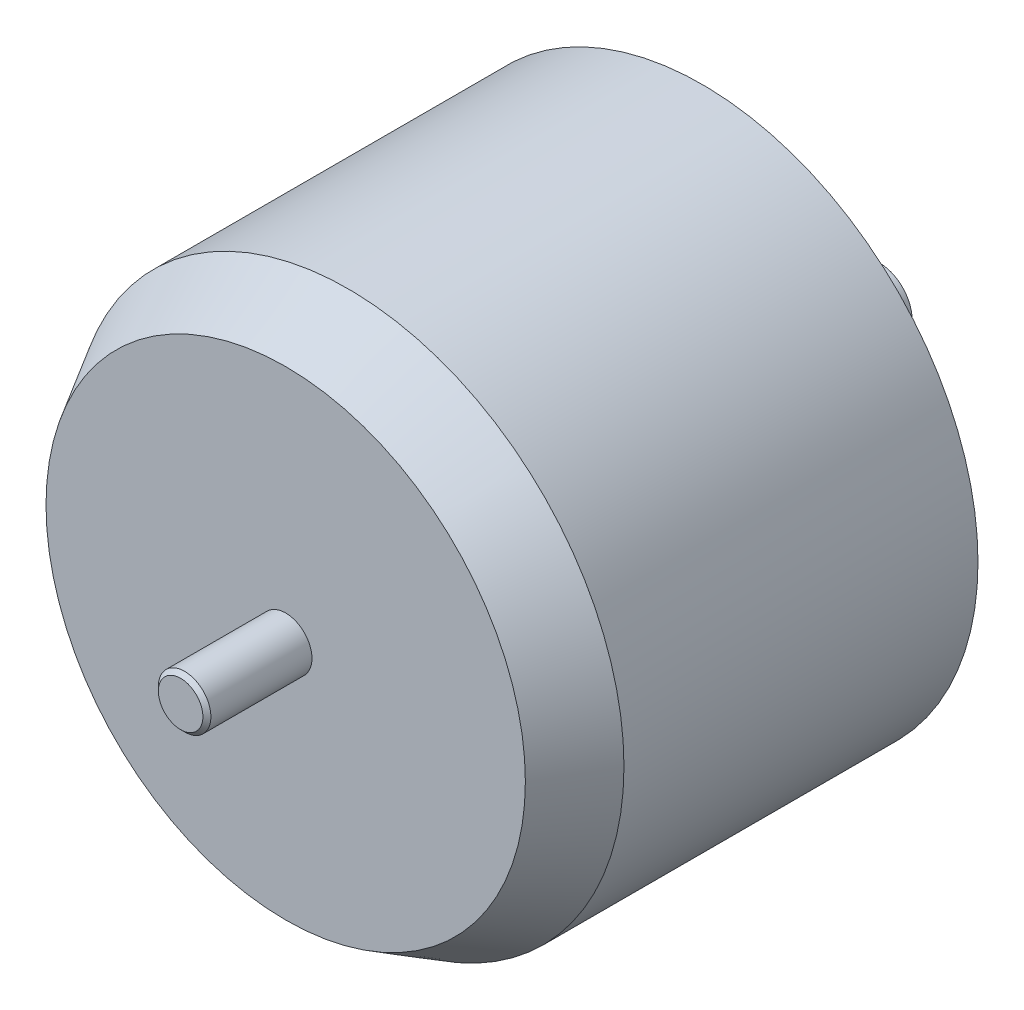
from build123d import *

# Parameters (mm, degrees)
BOSS_EXTRUDE1_START = 2
SKETCH2_R           = 1.25
BOSS_EXTRUDE1_DEPTH = 2


with BuildPart() as part:
    # Sketch1 → Revolve1 (revolve)
    with BuildSketch(Plane(origin=(0, 0, 0), x_dir=(1, 0, 0), z_dir=(0, 1, 0))):
        Polygon((1.25, 1.9), (0, 1.9), (0, -22.7), (0.8476, -22.7), (1, -22.5476), (1, -18.7), (9.125906359, -18.7), (10.5, -16.32), (10.5, -2.840563324), (5.58, 0), (2.75, 0), (2.75, 0.95), (1.25, 0.95), align=None)
    revolve(axis=Axis((0, 0, -1.9), (0, 0, 1)))

    # Sketch2 → Boss-Extrude1 (add)
    with BuildSketch(Plane(origin=(0, 0, -1.9), x_dir=(-1, 0, 0), z_dir=(0, 0, -1)).offset(BOSS_EXTRUDE1_START)):
        with Locations(Location((0, 0, 0), (0, 0, 180))):
            Circle(SKETCH2_R)
    extrude(amount=-BOSS_EXTRUDE1_DEPTH)


solid = part.part
